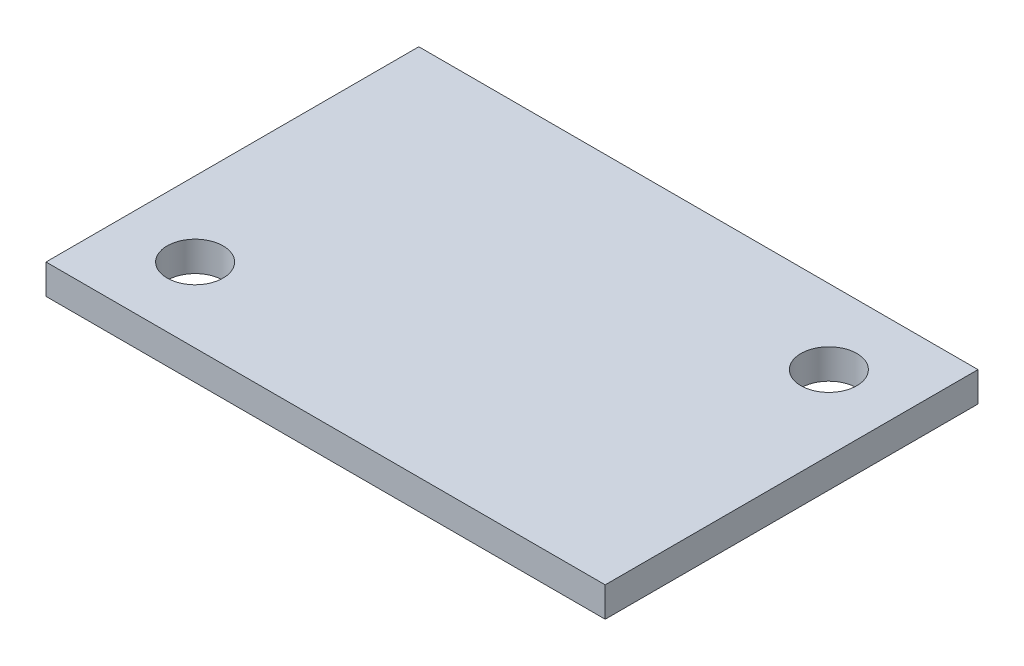
from build123d import *

# Parameters (mm, degrees)
SKETCH1_W           = 30
SKETCH1_H           = 20
SKETCH1_R           = 1.5
BOSS_EXTRUDE1_DEPTH = 1.6


with BuildPart() as part:
    # Sketch1 → Boss-Extrude1 (new body)
    with BuildSketch(Plane(origin=(0, 0, 0), x_dir=(1, 0, 0), z_dir=(0, 1, 0))):
        Rectangle(SKETCH1_W, SKETCH1_H)
        with Locations(Location((-11, -6, 0), (0, 0, 270))):
            Circle(SKETCH1_R, mode=Mode.SUBTRACT)
        with Locations(Location((11, 6, 0), (0, 0, 270))):
            Circle(SKETCH1_R, mode=Mode.SUBTRACT)
    extrude(amount=BOSS_EXTRUDE1_DEPTH)


solid = part.part
